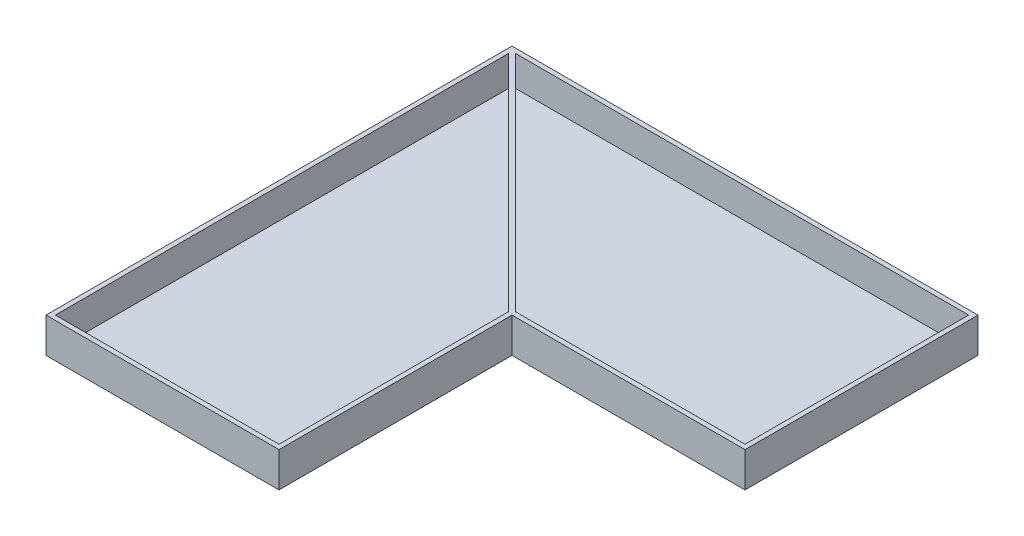
from build123d import *

# Parameters (mm, degrees)
EXTRUDE_1_DEPTH = 20
EXTRUDE_2_DEPTH = 130


with BuildPart() as part:
    # 草图1 → 凸台-拉伸1 (new body)
    with BuildSketch(Plane(origin=(0, 0, 0), x_dir=(1, 0, 0), z_dir=(0, 1, 0))):
        Polygon((0, 0), (0, -2000), (1000, -2000), (1000, -1000), (2000, -1000), (2000, 0), align=None)
    extrude(amount=EXTRUDE_1_DEPTH)

    # 草图3 → 凸台-拉伸2 (add)
    with BuildSketch(Plane(origin=(0, 20, 0), x_dir=(1, 0, 0), z_dir=(0, 1, 0))):
        Polygon((0, -2000), (1000, -2000), (1000, -1000), (2000, -1000), (2000, 0), (0, 0), align=None)
        Polygon((20, -34.142135624), (20, -1980), (980, -1980), (980, -994.142135624), align=None, mode=Mode.SUBTRACT)
        Polygon((994.142135624, -980), (1980, -980), (1980, -20), (34.142135624, -20), align=None, mode=Mode.SUBTRACT)
    extrude(amount=EXTRUDE_2_DEPTH)


solid = part.part
